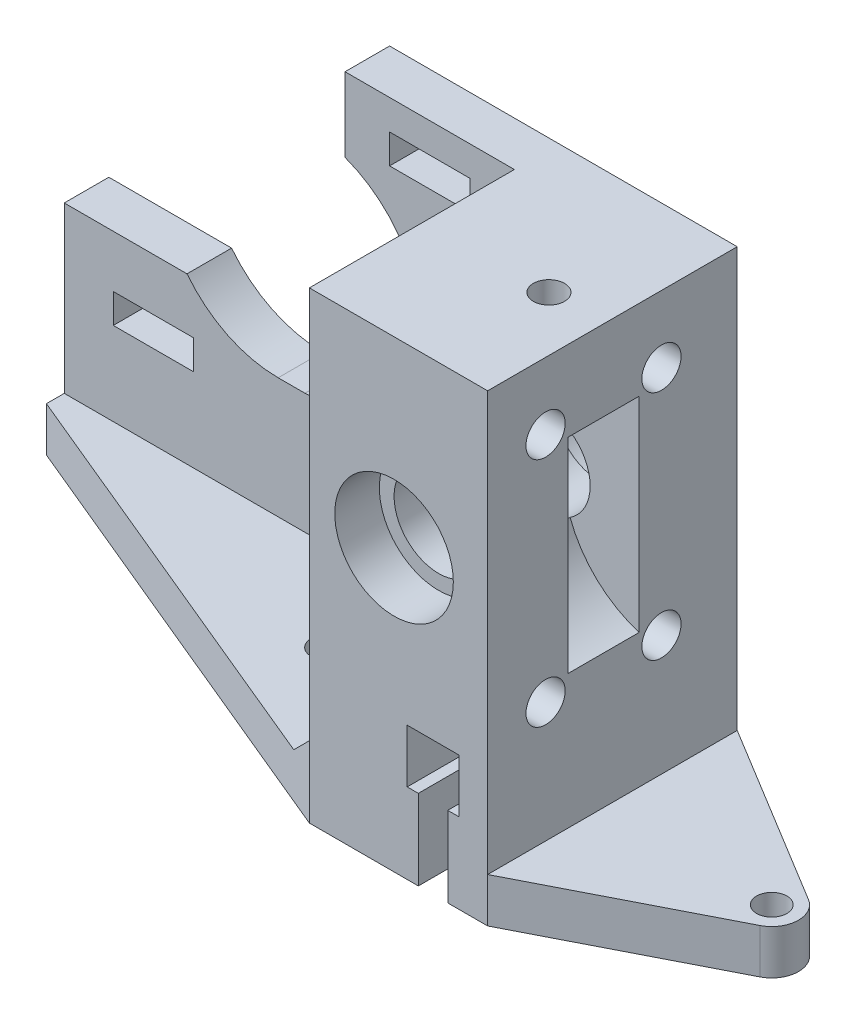
from build123d import *

# Parameters (mm, degrees)
SKETCH1_R               = 5
SKETCH1_W               = 9
SKETCH1_H               = 3.3
BOSS_EXTRUDE1_DEPTH     = 28
SKETCH2_W               = 50.5
SKETCH2_H               = 47
CUT_EXTRUDE1_DEPTH      = 23
SKETCH3_R               = 6.65
CUT_EXTRUDE2_DEPTH      = 5
CUT_EXTRUDE3_START      = -5
SKETCH4_R               = 6.65
CUT_EXTRUDE3_DEPTH      = 5
SKETCH5_R               = 12
CUT_EXTRUDE4_DEPTH      = 8
CUT_EXTRUDE5_START      = -9
CUT_EXTRUDE5_DEPTH      = 9
CUT_EXTRUDE6_DEPTH      = 6
SKETCH8_R               = 1.15
CUT_EXTRUDE7_DEPTH      = 85.190260719
CHAMFER1_SIZE           = 21
CHAMFER1_SIZE2          = 50.5
SKETCH9_R               = 2.2
CUT_EXTRUDE8_DEPTH      = 83.137080542
CUT_EXTRUDE9_DEPTH      = 3
CUT_EXTRUDE9_DEPTH_BACK = 7
SKETCH12_R              = 1.75
CUT_EXTRUDE10_DEPTH     = 10
CHAMFER2_SIZE           = 3
BOSS_EXTRUDE3_DEPTH     = 5
SKETCH15_R              = 1.7
CUT_EXTRUDE11_DEPTH     = 85.190260719


with BuildPart() as part:
    # Sketch1 → Boss-Extrude1 (new body)
    with BuildSketch(Plane.XY):
        with BuildLine():
            Line((-60, -31.5), (10.5, -31.5))
            Line((10.5, -31.5), (10.5, 20.5))
            Line((10.5, 20.5), (-28.5, 20.5))
            Line((-28.5, 20.5), (-28.5, 12.180409823))
            ThreePointArc((-28.5, 12.180409823), (-20.217668105, -2.285689125), (-33, -12.985083113))
            Line((-33, -12.985083113), (-36, -12.985083113))
            ThreePointArc((-36, -12.985083113), (-41.689100041, -11.672468641), (-46.228019527, -8))
            Line((-46.228019527, -8), (-60, -8))
            Line((-60, -8), (-60, -31.5))
        make_face()
        Circle(SKETCH1_R, mode=Mode.SUBTRACT)
        with Locations((-19, 15.5)):
            Rectangle(SKETCH1_W, SKETCH1_H, mode=Mode.SUBTRACT)
        with Locations((-19, -15.5)):
            Rectangle(SKETCH1_W, SKETCH1_H, mode=Mode.SUBTRACT)
        with Locations((-50, -15.5)):
            Rectangle(SKETCH1_W, SKETCH1_H, mode=Mode.SUBTRACT)
    extrude(amount=BOSS_EXTRUDE1_DEPTH)

    # Sketch2 → Cut-Extrude1 (cut)
    with BuildSketch(Plane.XY.offset(28)):
        with Locations((-34.75, -3)):
            Rectangle(SKETCH2_W, SKETCH2_H)
    extrude(amount=-CUT_EXTRUDE1_DEPTH, mode=Mode.SUBTRACT)

    # Sketch3 → Cut-Extrude2 (cut)
    with BuildSketch(Plane.XY.offset(28)):
        Circle(SKETCH3_R)
    extrude(amount=-CUT_EXTRUDE2_DEPTH, mode=Mode.SUBTRACT)

    # Sketch4 → Cut-Extrude3 (cut)
    with BuildSketch(Plane(origin=(0, 0, 0), x_dir=(-1, 0, 0), z_dir=(0, 0, -1)).offset(CUT_EXTRUDE3_START)):
        with Locations(Location((0, 0, 0), (0, 0, 180))):
            Circle(SKETCH4_R)
    extrude(amount=CUT_EXTRUDE3_DEPTH, mode=Mode.SUBTRACT)

    # Sketch5 → Cut-Extrude4 (cut)
    with BuildSketch(Plane.XY.offset(11)):
        with Locations((14, 0)):
            Circle(SKETCH5_R)
    extrude(amount=CUT_EXTRUDE4_DEPTH, mode=Mode.SUBTRACT)

    # Sketch6 → Cut-Extrude5 (cut)
    with BuildSketch(Plane.XZ.offset(31.5).offset(CUT_EXTRUDE5_START)):
        with BuildLine():
            Line((2.725, 15), (2.725, 28))
            Line((2.725, 28), (6.025, 28))
            Line((6.025, 28), (6.025, 15))
            ThreePointArc((6.025, 15), (4.375, 13.35), (2.725, 15))
        make_face()
    extrude(amount=CUT_EXTRUDE5_DEPTH, mode=Mode.SUBTRACT)

    # Sketch7 → Cut-Extrude6 (cut)
    with BuildSketch(Plane.XZ.offset(22.5)):
        Polygon((1.475, 28), (7.275, 28), (7.275, 13.325684219), (4.375, 11.651368439), (1.475, 13.325684219), align=None)
    extrude(amount=-CUT_EXTRUDE6_DEPTH, mode=Mode.SUBTRACT)

    # Sketch8 → Cut-Extrude7 (cut, through all)
    with BuildSketch(Plane.XZ.offset(31.5)):
        with Locations(Location((4.375, 15, 0), (0, 0, 270))):
            Circle(SKETCH8_R)
    extrude(amount=-CUT_EXTRUDE7_DEPTH, mode=Mode.SUBTRACT)

    # Chamfer1
    chamfer1_edges = [part.edges().sort_by_distance(p)[0] for p in [
        (-60, -29, 28),
    ]]
    chamfer1_side = [part.faces().sort_by_distance(p)[0] for p in [
        (-60, -19.75, 0.365547535),
    ]]
    chamfer(chamfer1_edges, length=CHAMFER1_SIZE, length2=CHAMFER1_SIZE2, reference=chamfer1_side[0])

    # Sketch9 → Cut-Extrude8 (cut, through all)
    with BuildSketch(Plane(origin=(10.5, 0, 0), x_dir=(0, 0, -1), z_dir=(1, 0, 0))):
        with Locations((-8.5, 13)):
            Circle(SKETCH9_R)
        with Locations(Location((-21.5, 13, 0), (0, 0, 90))):
            Circle(SKETCH9_R)
        with Locations(Location((-8.5, -13, 0), (0, 0, 90))):
            Circle(SKETCH9_R)
        with Locations((-21.5, -13)):
            Circle(SKETCH9_R)
    extrude(amount=-CUT_EXTRUDE8_DEPTH, mode=Mode.SUBTRACT)

    # Sketch10 → Cut-Extrude9 (cut, two sides: drawn at the far end of the back side and taken through both)
    with BuildSketch(Plane.ZY.offset(9.5).offset(-CUT_EXTRUDE9_DEPTH_BACK)):
        Polygon((4.85, 15.107328483), (4.85, 10.892671517), (8.5, 8.785343035), (12.15, 10.892671517), (12.15, 15.107328483), (8.5, 17.214656965), align=None)
        Polygon((25.15, 10.892671517), (25.15, 15.107328483), (21.5, 17.214656965), (17.85, 15.107328483), (17.85, 10.892671517), (21.5, 8.785343035), align=None)
        Polygon((25.15, -10.892671517), (21.5, -8.785343035), (17.85, -10.892671517), (17.85, -15.107328483), (21.5, -17.214656965), (25.15, -15.107328483), align=None)
        Polygon((12.15, -10.892671517), (8.5, -8.785343035), (4.85, -10.892671517), (4.85, -15.107328483), (8.5, -17.214656965), (12.15, -15.107328483), align=None)
    extrude(amount=CUT_EXTRUDE9_DEPTH + CUT_EXTRUDE9_DEPTH_BACK, mode=Mode.SUBTRACT)

    # Sketch12 → Cut-Extrude10 (cut)
    with BuildSketch(Plane(origin=(0, 20.5, 0), x_dir=(1, 0, 0), z_dir=(0, 1, 0))):
        with Locations(Location((4.375, -15, 0), (0, 0, 270))):
            Circle(SKETCH12_R)
    extrude(amount=-CUT_EXTRUDE10_DEPTH, mode=Mode.SUBTRACT)

    # Chamfer2
    chamfer2_edges = [part.edges().sort_by_distance(p)[0] for p in [
        (-9.5, -26.5, 16.5),
    ]]
    chamfer(chamfer2_edges, length=CHAMFER2_SIZE)

    # Sketch14 → Boss-Extrude3 (add)
    with BuildSketch(Plane.XZ.offset(31.5)):
        with BuildLine():
            Line((10.5, 0), (30.934731544, 12.437337808))
            ThreePointArc((30.934731544, 12.437337808), (32.372897026, 15.112309482), (30.73861997, 17.672178994))
            Line((30.73861997, 17.672178994), (10.5, 28))
            Line((10.5, 28), (10.5, 0))
        make_face()
    extrude(amount=-BOSS_EXTRUDE3_DEPTH)

    # Sketch15 → Cut-Extrude11 (cut, through all)
    with BuildSketch(Plane.XZ.offset(31.5)):
        with Locations(Location((-20.625, 15, 0), (0, 0, 270))):
            Circle(SKETCH15_R)
        with Locations(Location((29.375, 15, 0), (0, 0, 270))):
            Circle(SKETCH15_R)
    extrude(amount=-CUT_EXTRUDE11_DEPTH, mode=Mode.SUBTRACT)


solid = part.part
